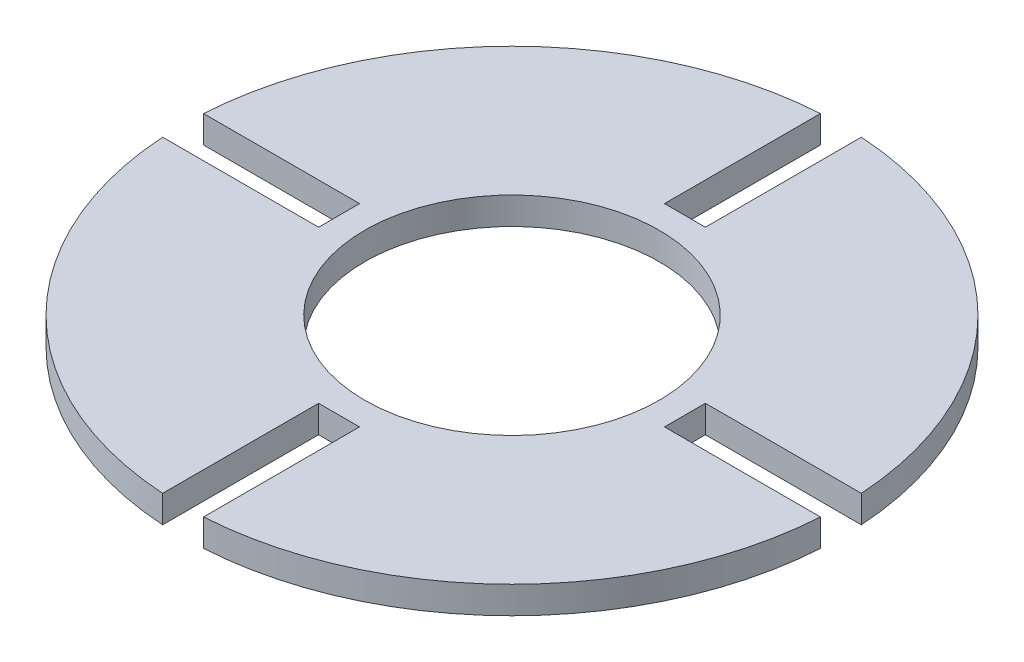
from build123d import *

# Parameters (mm, degrees)
SKETCH1_R           = 10.795
BOSS_EXTRUDE1_DEPTH = 2


with BuildPart() as part:
    # Sketch1 → Boss-Extrude1 (new body)
    with BuildSketch(Plane(origin=(0, 0, 0), x_dir=(1, 0, 0), z_dir=(0, 1, 0))):
        with BuildLine():
            Line((-1.5, 24.103371134), (-1.5, 12.673371134))
            Line((-1.5, 12.673371134), (1.5, 12.673371134))
            Line((1.5, 12.673371134), (1.5, 24.103371134))
            ThreePointArc((1.5, 24.103371134), (17.076628766, 17.076628766), (24.103371134, 1.5))
            Line((24.103371134, 1.5), (12.673371134, 1.5))
            Line((12.673371134, 1.5), (12.673371134, -1.5))
            Line((12.673371134, -1.5), (24.103371134, -1.5))
            ThreePointArc((24.103371134, -1.5), (17.076628766, -17.076628766), (1.5, -24.103371134))
            Line((1.5, -24.103371134), (1.5, -12.673371134))
            Line((1.5, -12.673371134), (-1.5, -12.673371134))
            Line((-1.5, -12.673371134), (-1.5, -24.103371134))
            ThreePointArc((-1.5, -24.103371134), (-17.076628766, -17.076628766), (-24.103371134, -1.5))
            Line((-24.103371134, -1.5), (-12.673371134, -1.5))
            Line((-12.673371134, -1.5), (-12.673371134, 1.5))
            Line((-12.673371134, 1.5), (-24.103371134, 1.5))
            ThreePointArc((-24.103371134, 1.5), (-17.076628766, 17.076628766), (-1.5, 24.103371134))
        make_face()
        with Locations(Location((0, 0, 0), (0, 0, 270))):
            Circle(SKETCH1_R, mode=Mode.SUBTRACT)
    extrude(amount=BOSS_EXTRUDE1_DEPTH)


solid = part.part
